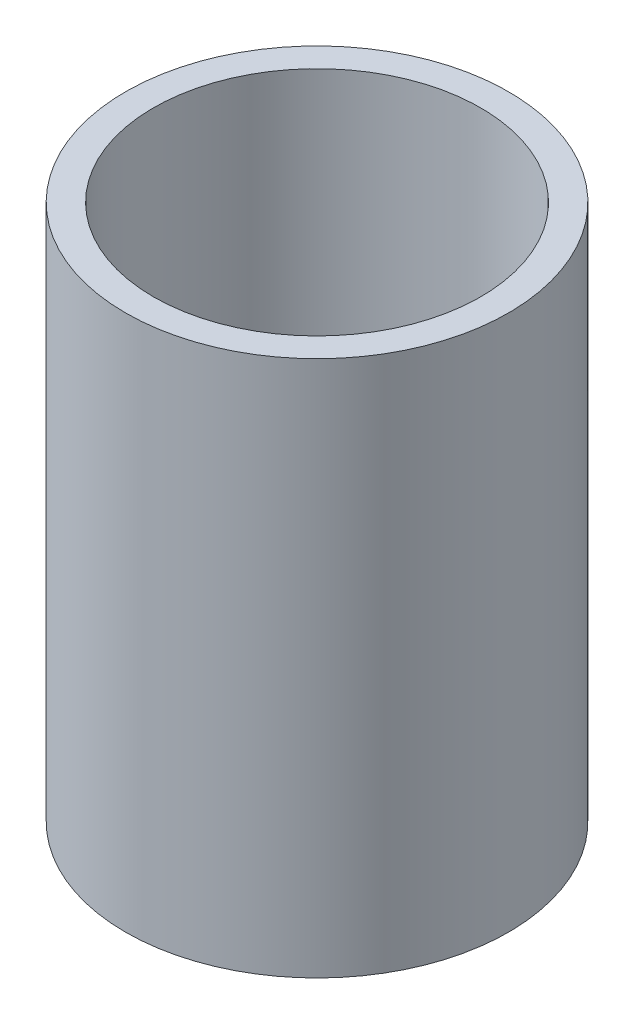
from build123d import *

# Parameters (mm, degrees)
CROQUIS1_R              = 27.5
CROQUIS1_R_2            = 23.5
SALIENTE_EXTRUIR1_DEPTH = 77


with BuildPart() as part:
    # Croquis1 → Saliente-Extruir1 (new body)
    with BuildSketch(Plane(origin=(0, 0, 0), x_dir=(1, 0, 0), z_dir=(0, 1, 0))):
        with Locations(Location((0, 0, 0), (0, 0, 270))):
            Circle(CROQUIS1_R)
        with Locations(Location((0, 0, 0), (0, 0, 270))):
            Circle(CROQUIS1_R_2, mode=Mode.SUBTRACT)
    extrude(amount=SALIENTE_EXTRUIR1_DEPTH)


solid = part.part
